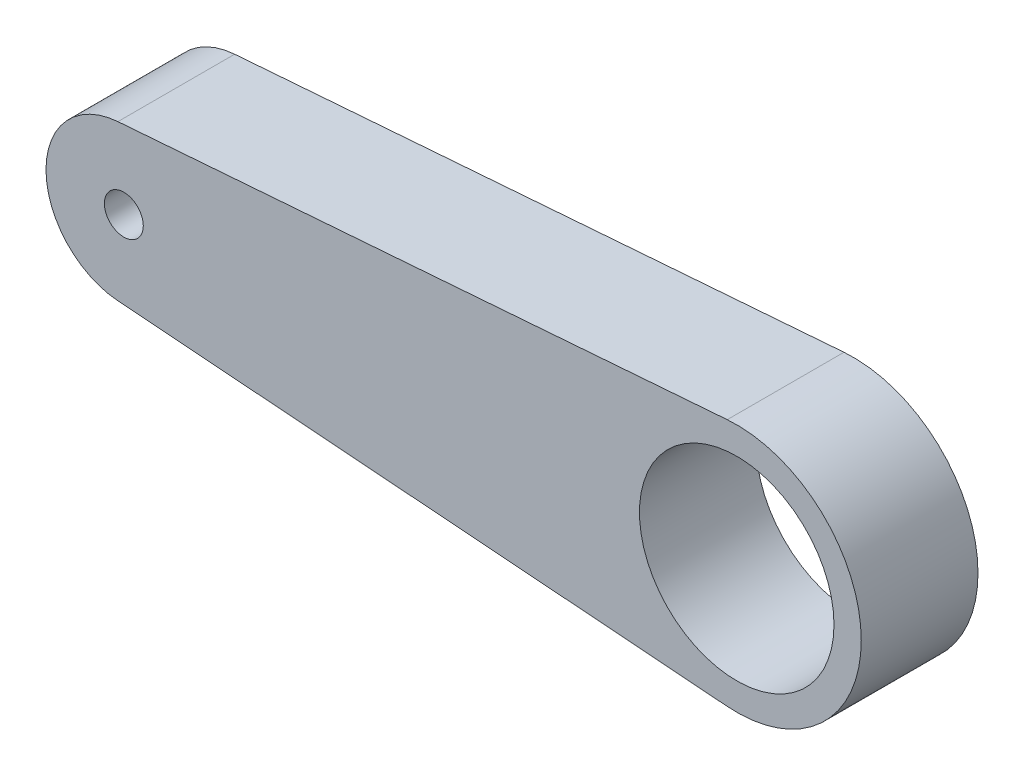
from build123d import *

# Parameters (mm, degrees)
CROQUIS2_R              = 2.5
CROQUIS2_R_2            = 0.5
SALIENTE_EXTRUIR1_DEPTH = 1.5


with BuildPart() as part:
    # Croquis2 → Saliente-Extruir1 (new, symmetric)
    with BuildSketch(Plane.XY):
        with BuildLine():
            ThreePointArc((-0.152380952, 1.994186562), (-2, 0), (-0.152380952, -1.994186562))
            Line((-0.152380952, -1.994186562), (15.506190476, -3.1906985))
            ThreePointArc((15.506190476, -3.1906985), (18.95, 0), (15.506190476, 3.1906985))
            Line((15.506190476, 3.1906985), (-0.152380952, 1.994186562))
        make_face()
        with Locations((15.75, 0)):
            Circle(CROQUIS2_R, mode=Mode.SUBTRACT)
        Circle(CROQUIS2_R_2, mode=Mode.SUBTRACT)
    extrude(amount=SALIENTE_EXTRUIR1_DEPTH, both=True)


solid = part.part
